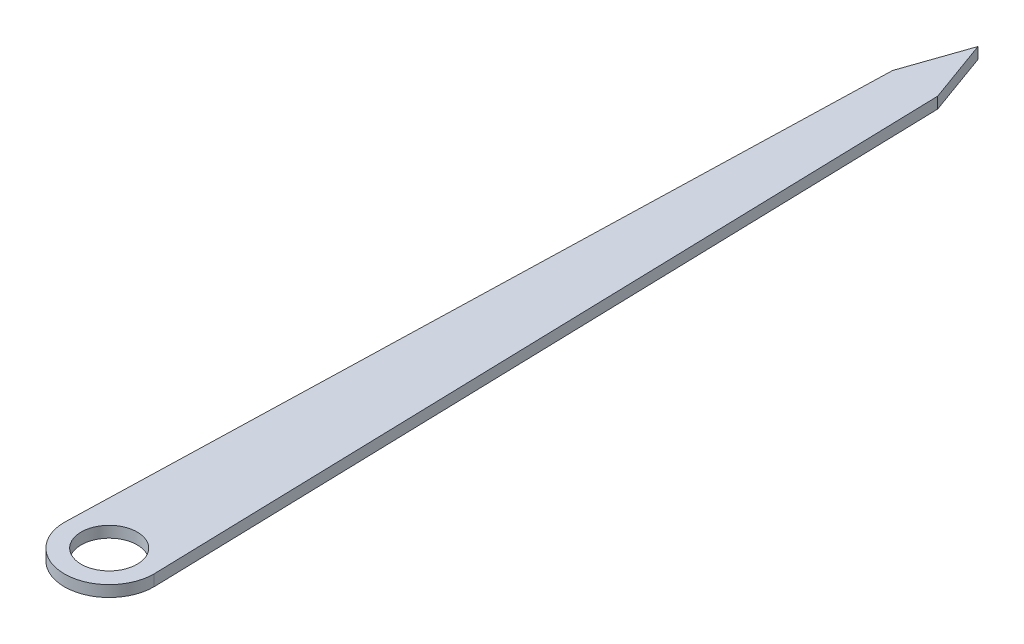
from build123d import *

# Parameters (mm, degrees)
SKICA1_R                 = 2
P_IDAT_VYSUNUT_M3_DEPTH  = 2
ODEBRAT_START            = -18
SKICA5_R                 = 2.5
SKICA5_R_2               = 2
ODEBRAT_VYSUNUT_M1_DEPTH = 18
SKICA1_6_R               = 2
ODEBRAT_VYSUNUT_M3_DEPTH = 1


with BuildPart() as part:
    # Skica1 → Přidat vysunutím3 (new body)
    with BuildSketch(Plane(origin=(0, 0, 0), x_dir=(1, 0, 0), z_dir=(0, 1, 0))):
        with BuildLine():
            ThreePointArc((106, 34), (110, 30), (114, 34))
            Line((114, 34), (112.040914438, 106))
            Line((112.040914438, 106), (110, 111.642221926))
            Line((110, 111.642221926), (108.040914438, 105.971068272))
            Line((108.040914438, 105.971068272), (106, 34))
        make_face()
        with Locations((110, 34)):
            Circle(SKICA1_R, mode=Mode.SUBTRACT)
    extrude(amount=P_IDAT_VYSUNUT_M3_DEPTH)

    # Skica5 → Odebrat vysunutím1 (cut)
    with BuildSketch(Plane(origin=(0, 2, 0), x_dir=(1, 0, 0), z_dir=(0, 1, 0)).offset(ODEBRAT_START)):
        with Locations((110, 34)):
            Circle(SKICA5_R)
        with Locations((110, 34)):
            Circle(SKICA5_R_2, mode=Mode.SUBTRACT)
    extrude(amount=ODEBRAT_VYSUNUT_M1_DEPTH, mode=Mode.SUBTRACT)

    # Skica1<6> → Odebrat vysunutím3 (cut)
    with BuildSketch(Plane(origin=(0, 0, 0), x_dir=(1, 0, 0), z_dir=(0, 1, 0))):
        with BuildLine():
            ThreePointArc((106, 34), (110, 30), (114, 34))
            Line((114, 34), (112.040914438, 106))
            Line((112.040914438, 106), (110, 111.642221926))
            Line((110, 111.642221926), (108.040914438, 105.971068272))
            Line((108.040914438, 105.971068272), (106, 34))
        make_face()
        with Locations((110, 34)):
            Circle(SKICA1_6_R, mode=Mode.SUBTRACT)
    extrude(amount=ODEBRAT_VYSUNUT_M3_DEPTH, mode=Mode.SUBTRACT)


solid = part.part
